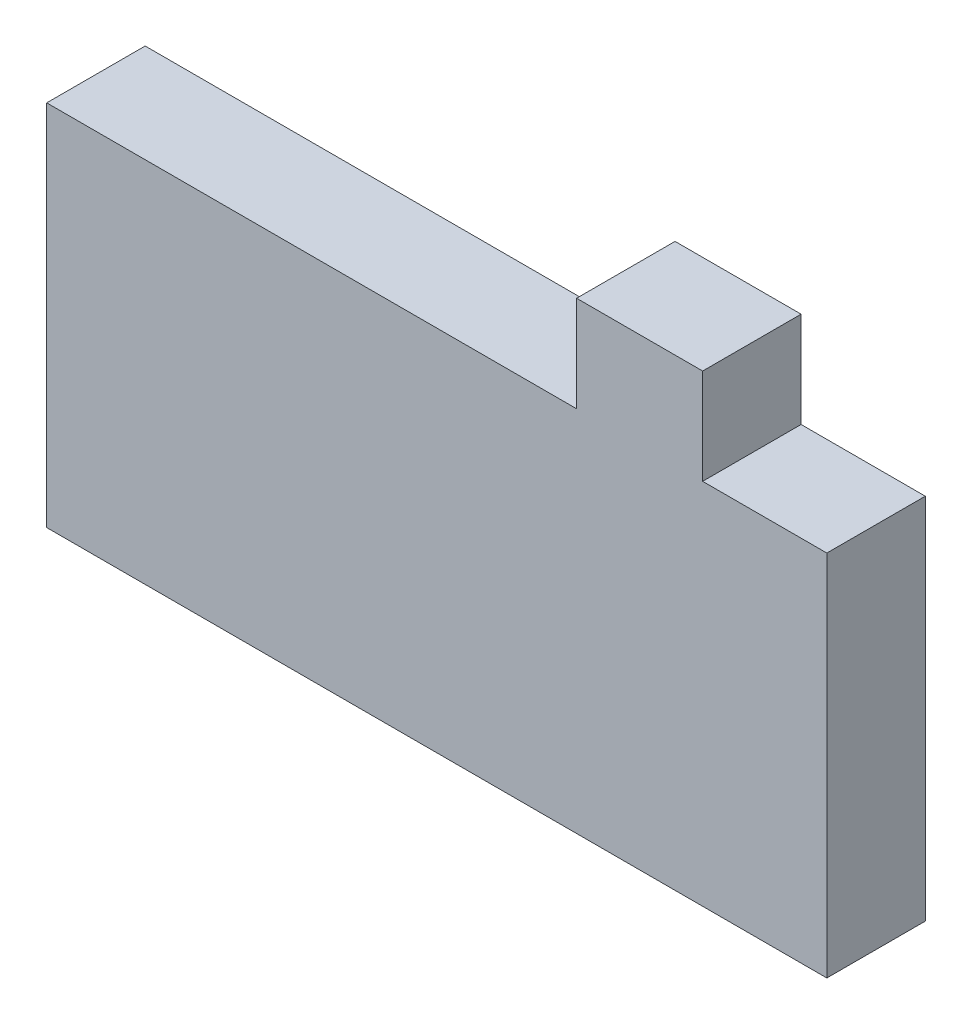
from build123d import *

# Parameters (mm, degrees)
BOSS_EXTRUDE1_DEPTH = 20
SHELL1_T            = -5


with BuildPart() as part:
    # Sketch2 → Boss-Extrude1 (new body)
    with BuildSketch(Plane.XY):
        Polygon((-61.336329504, -46.981018343), (97.131391098, -46.981018343), (97.131391098, 27.778459258), (71.904316974, 27.778459258), (71.904316974, 47.185045125), (46.299911218, 47.185045125), (46.299911218, 27.739957348), (-61.336329504, 27.739957348), align=None)
    extrude(amount=BOSS_EXTRUDE1_DEPTH)

    # Shell1
    shell1_openings = [part.faces().sort_by_distance(p)[0] for p in [
        (19.565287633, -7.717892988, 0),
    ]]
    offset(amount=SHELL1_T, openings=shell1_openings, kind=Kind.INTERSECTION)


solid = part.part
